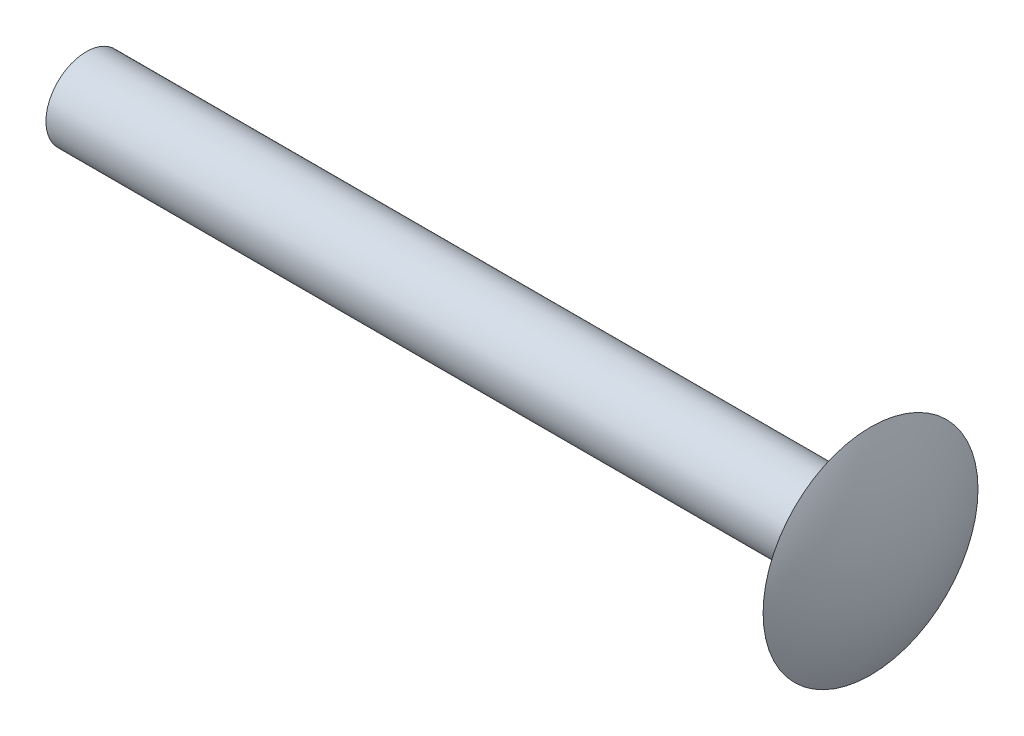
from build123d import *

# Parameters (mm, degrees)
SHAFT_SKETCH_R      = 7.5
SHAFT_EXTRUDE_DEPTH = 146


with BuildPart() as part:
    # Shaft Sketch → Shaft Extrude (new body)
    with BuildSketch(Plane(origin=(0, 0, 0), x_dir=(0, 0, -1), z_dir=(1, 0, 0))):
        Circle(SHAFT_SKETCH_R)
    extrude(amount=SHAFT_EXTRUDE_DEPTH)

    # Head Sketch → Head Revolution (revolve)
    with BuildSketch(Plane.XY, mode=Mode.PRIVATE) as head_revolution_sk:
        with BuildLine():
            Line((151, 0), (146, 0))
            Line((146, 0), (146, 20))
            ThreePointArc((146, 20), (149.731056256, 10.307764064), (151, 0))
        make_face()
    revolve(head_revolution_sk.sketch.rotate(Axis((151, 0, 0), (-1, 0, 0)), 180), axis=Axis((151, 0, 0), (-1, 0, 0)))


solid = part.part
